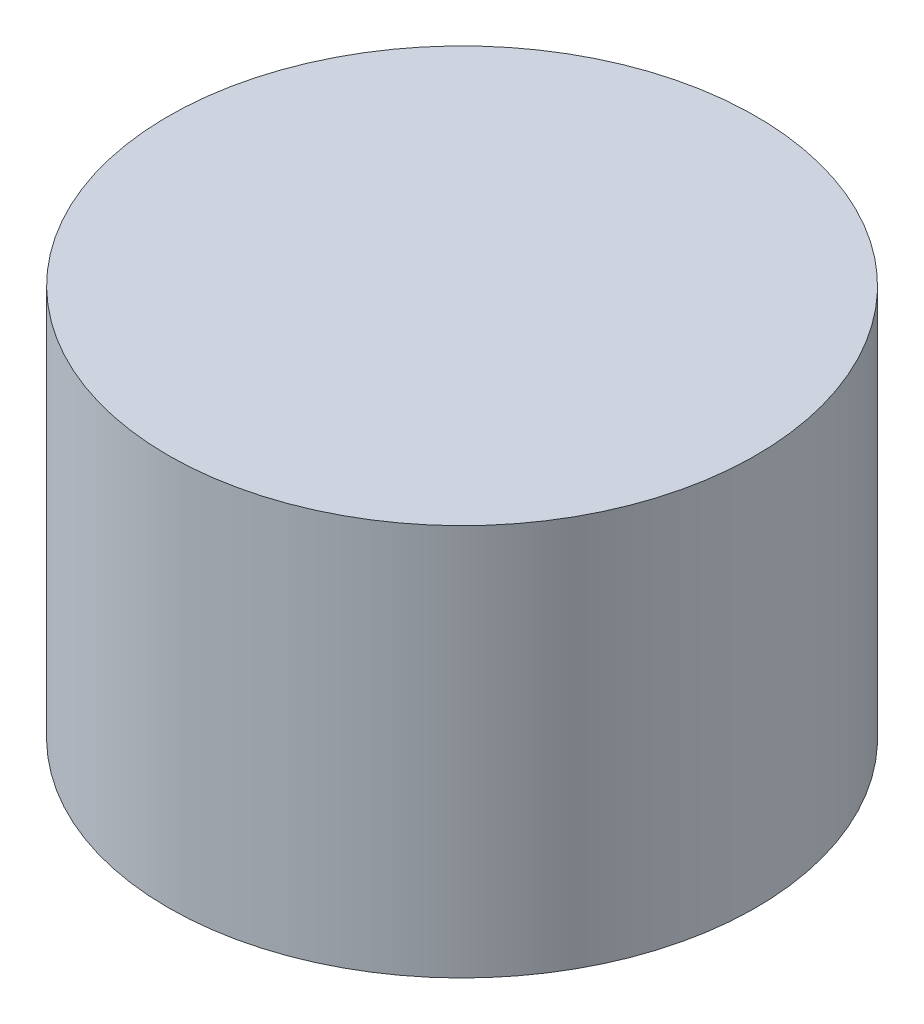
from build123d import *

# Parameters (mm, degrees)
SKETCH1_R           = 3.81
BOSS_EXTRUDE1_DEPTH = 5.08


with BuildPart() as part:
    # Sketch1 → Boss-Extrude1 (new body)
    with BuildSketch(Plane(origin=(0, 0, 0), x_dir=(1, 0, 0), z_dir=(0, 1, 0))):
        with Locations(Location((0, 0, 0), (0, 0, 270))):
            Circle(SKETCH1_R)
    extrude(amount=BOSS_EXTRUDE1_DEPTH)


solid = part.part
